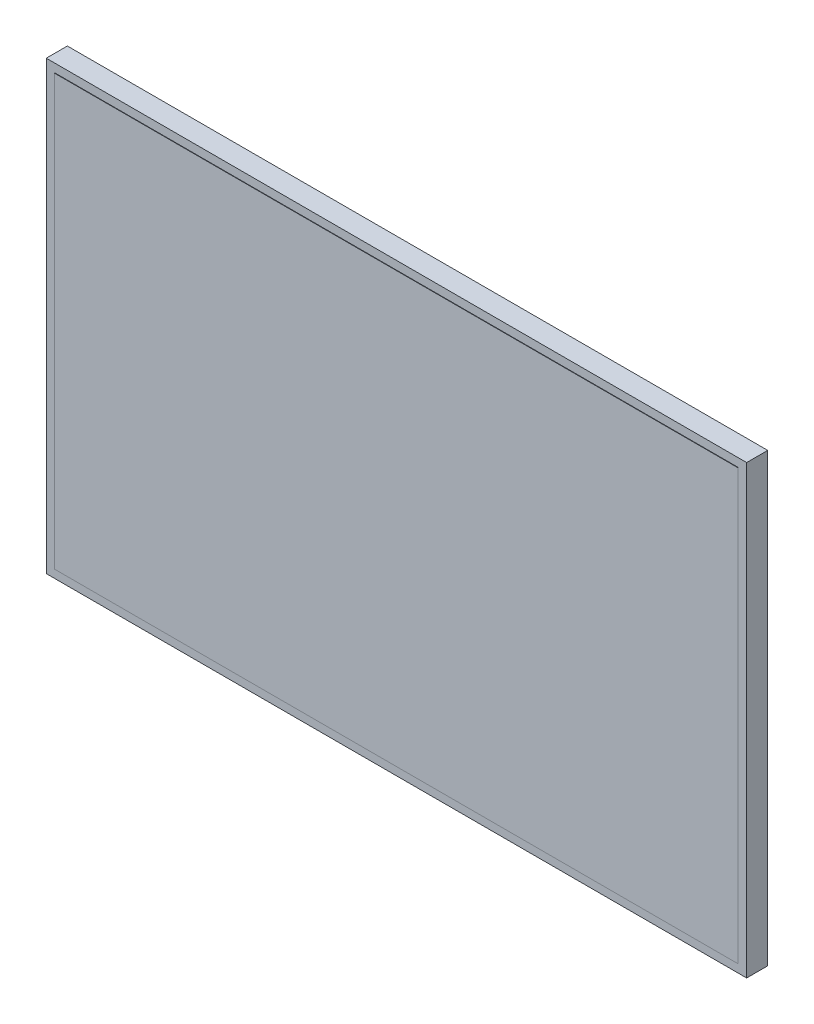
from build123d import *

# Parameters (mm, degrees)
CROQUIS1_W              = 166
CROQUIS1_H              = 105.8
SALIENTE_EXTRUIR1_DEPTH = 2.5
CROQUIS3_W              = 162
CROQUIS3_H              = 101.8
SALIENTE_EXTRUIR2_DEPTH = 0.1


with BuildPart() as part:
    # Croquis1 → Saliente-Extruir1 (new, symmetric)
    with BuildSketch(Plane.XY):
        Rectangle(CROQUIS1_W, CROQUIS1_H)
    extrude(amount=SALIENTE_EXTRUIR1_DEPTH, both=True)

    # Croquis3 → Saliente-Extruir2 (add)
    with BuildSketch(Plane.XY.offset(2.5)):
        Rectangle(CROQUIS3_W, CROQUIS3_H)
    extrude(amount=SALIENTE_EXTRUIR2_DEPTH)


solid = part.part
